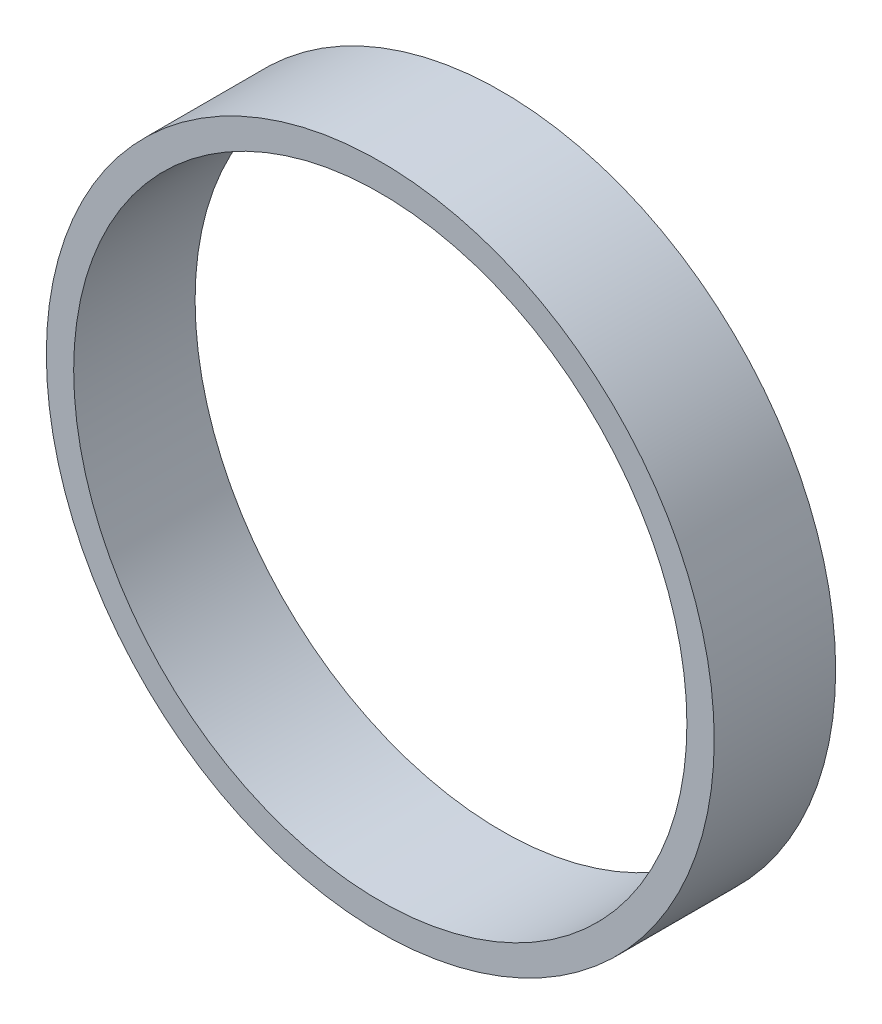
from build123d import *

# Parameters (mm, degrees)
SZKIC1_R                    = 5.5
SZKIC1_R_2                  = 5.05
DODANIE_WYCI_GNI_CIE1_DEPTH = 2


with BuildPart() as part:
    # Szkic1 → Dodanie-wyciągnięcie1 (new body)
    with BuildSketch(Plane.XY):
        Circle(SZKIC1_R)
        Circle(SZKIC1_R_2, mode=Mode.SUBTRACT)
    extrude(amount=DODANIE_WYCI_GNI_CIE1_DEPTH)


solid = part.part
